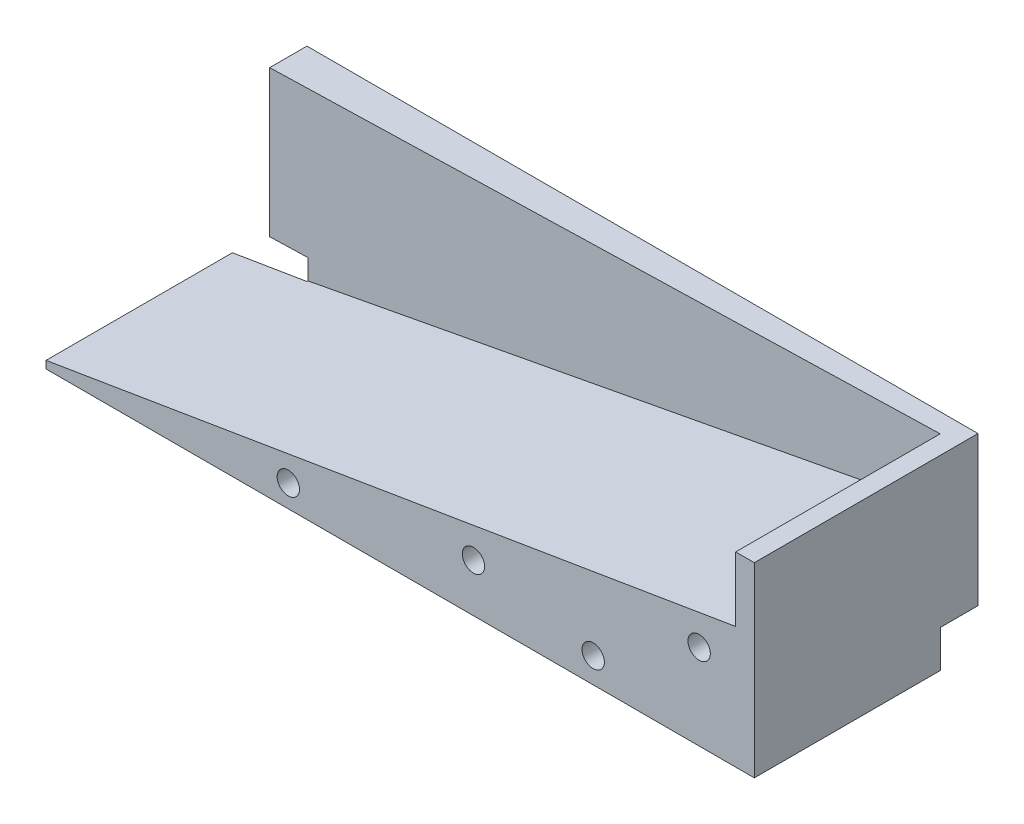
from build123d import *

# Parameters (mm, degrees)
ESQUISSE1_R             = 3
BOSS_EXTRU_1_DEPTH      = 200
ESQUISSE4_W             = 5
ESQUISSE4_H             = 50
BOSS_EXTRU_4_DEPTH      = 180
BOSS_EXTRU_7_DEPTH      = 50
ESQUISSE6_W             = 20
ESQUISSE6_H             = 10.719834163
ENL_V_MAT_EXTRU_2_DEPTH = 10
ESQUISSE5_W             = 10
ESQUISSE5_H             = 10
ENL_V_MAT_EXTRU_1_DEPTH = 10
ESQUISSE14_R            = 5
ENL_V_MAT_EXTRU_4_DEPTH = 15
BOSS_EXTRU_8_REACH      = 242.401
ENL_V_MAT_EXTRU_5_REACH = 238.046
ESQUISSE16_W            = 190
ESQUISSE16_H            = 150


with BuildPart() as part:
    # Esquisse1 → Boss.-Extru.1 (new body)
    with BuildSketch(Plane.XY):
        Polygon((-105.796013405, 0), (84.203986595, 0), (84.203986595, 33.502126335), (-105.796013405, 2), align=None)
        with Locations((69.406004871, 22.939397164)):
            Circle(ESQUISSE1_R, mode=Mode.SUBTRACT)
        with Locations((40.981469067, 6.77616521)):
            Circle(ESQUISSE1_R, mode=Mode.SUBTRACT)
        with Locations((-40.796013405, 6)):
            Circle(ESQUISSE1_R, mode=Mode.SUBTRACT)
        with Locations((8.861542866, 12.901085106)):
            Circle(ESQUISSE1_R, mode=Mode.SUBTRACT)
    extrude(amount=BOSS_EXTRU_1_DEPTH)

    # Esquisse4 → Boss.-Extru.4 (add)
    with BuildSketch(Plane(origin=(84.203986595, 0, 0), x_dir=(0, 0, -1), z_dir=(1, 0, 0))):
        with Locations((-202.5, 25)):
            Rectangle(ESQUISSE4_W, ESQUISSE4_H)
        with Locations((2.5, 25)):
            Rectangle(ESQUISSE4_W, ESQUISSE4_H)
    extrude(amount=-BOSS_EXTRU_4_DEPTH)

    # Esquisse8 → Boss.-Extru.7 (add)
    with BuildSketch(Plane(origin=(0, 50, 0), x_dir=(1, 0, 0), z_dir=(0, 1, 0))):
        Polygon((84.203986595, 0), (-95.796013405, 0), (-95.796013405, -5), align=None)
    boss_extru_7 = extrude(amount=-BOSS_EXTRU_7_DEPTH)

    # Esquisse6 → Enlèv. mat.-Extru.2 (cut)
    with BuildSketch(Plane(origin=(0, 0, -5), x_dir=(-1, 0, 0), z_dir=(0, 0, -1))):
        with Locations((95.796013405, 5.359917081)):
            Rectangle(ESQUISSE6_W, ESQUISSE6_H)
    enl_v_mat_extru_2 = extrude(amount=-ENL_V_MAT_EXTRU_2_DEPTH, mode=Mode.SUBTRACT)

    # Esquisse5 → Enlèv. mat.-Extru.1 (cut)
    with BuildSketch(Plane(origin=(84.203986595, 0, 0), x_dir=(0, 0, -1), z_dir=(1, 0, 0))):
        with Locations((-200, 5)):
            Rectangle(ESQUISSE5_W, ESQUISSE5_H)
        with Locations((0, 5)):
            Rectangle(ESQUISSE5_W, ESQUISSE5_H)
    extrude(amount=-ENL_V_MAT_EXTRU_1_DEPTH, mode=Mode.SUBTRACT)

    # Esquisse14 → Enlèv. mat.-Extru.4 (cut)
    with BuildSketch(Plane(origin=(0, 0, -5), x_dir=(-1, 0, 0), z_dir=(0, 0, -1))):
        with Locations((-69.406004871, 22.939397164)):
            Circle(ESQUISSE14_R)
        with Locations((-40.981469067, 6.77616521)):
            Circle(ESQUISSE14_R)
        with Locations((-8.861542866, 12.901085106)):
            Circle(ESQUISSE14_R)
        with Locations((40.796013405, 6)):
            Circle(ESQUISSE14_R)
    enl_v_mat_extru_4 = extrude(amount=-ENL_V_MAT_EXTRU_4_DEPTH, mode=Mode.SUBTRACT)

    # Symétrie3: Boss.-Extru.7, Enlèv. mat.-Extru.2, Enlèv. mat.-Extru.4 across plane
    add(boss_extru_7.mirror(Plane(origin=(0, 0, 100), x_dir=(1, 0, 0), z_dir=(0, 0, -1))))
    add(enl_v_mat_extru_2.mirror(Plane(origin=(0, 0, 100), x_dir=(1, 0, 0), z_dir=(0, 0, -1))), mode=Mode.SUBTRACT)
    add(enl_v_mat_extru_4.mirror(Plane(origin=(0, 0, 100), x_dir=(1, 0, 0), z_dir=(0, 0, -1))), mode=Mode.SUBTRACT)

    # Boss.-Extru.8: up to this plane
    boss_extru_8_end = Plane(origin=(-95.796013405, -180.069431054, 195), z_dir=(-0.0277670672403533, 0, 0.9996144206527183))
    # Esquisse15 → Boss.-Extru.8 (add, up to the surface)
    with BuildSketch(Plane(origin=(0, 0, -5), x_dir=(-1, 0, 0), z_dir=(0, 0, -1)), mode=Mode.PRIVATE) as boss_extru_8_sk1:
        Polygon((-84.203986595, 33.502126335), (-79.203986595, 32.67312301), (-79.203986595, 50), (-84.203986595, 50), align=None)
    boss_extru_8_tool1 = split(extrude(boss_extru_8_sk1.sketch, amount=-BOSS_EXTRU_8_REACH, mode=Mode.PRIVATE), bisect_by=boss_extru_8_end, keep=Keep.BOTH, mode=Mode.PRIVATE)
    add(boss_extru_8_tool1.solids().sort_by_distance((81.683563, 41.542119, -5))[0])

    # Enlèv. mat.-Extru.5: up to this face of the body (flat: up to its plane)
    enl_v_mat_extru_5_end = Plane(part.part.faces().sort_by_distance((-10.38578146, 0, 100.003530671))[0])
    # Esquisse16 → Enlèv. mat.-Extru.5 (cut, up to the picked face)
    with BuildSketch(Plane(origin=(0, 50, 0), x_dir=(1, 0, 0), z_dir=(0, 1, 0)), mode=Mode.PRIVATE) as enl_v_mat_extru_5_sk1:
        with Locations((-10.796013405, -130)):
            Rectangle(ESQUISSE16_W, ESQUISSE16_H)
    enl_v_mat_extru_5_tool1 = split(extrude(enl_v_mat_extru_5_sk1.sketch, amount=-ENL_V_MAT_EXTRU_5_REACH, mode=Mode.PRIVATE), bisect_by=enl_v_mat_extru_5_end, keep=Keep.BOTH, mode=Mode.PRIVATE)
    add(enl_v_mat_extru_5_tool1.solids().sort_by(Axis((-10.796013, 50, 130), (0, -1, 0)))[0], mode=Mode.SUBTRACT)


solid = part.part
